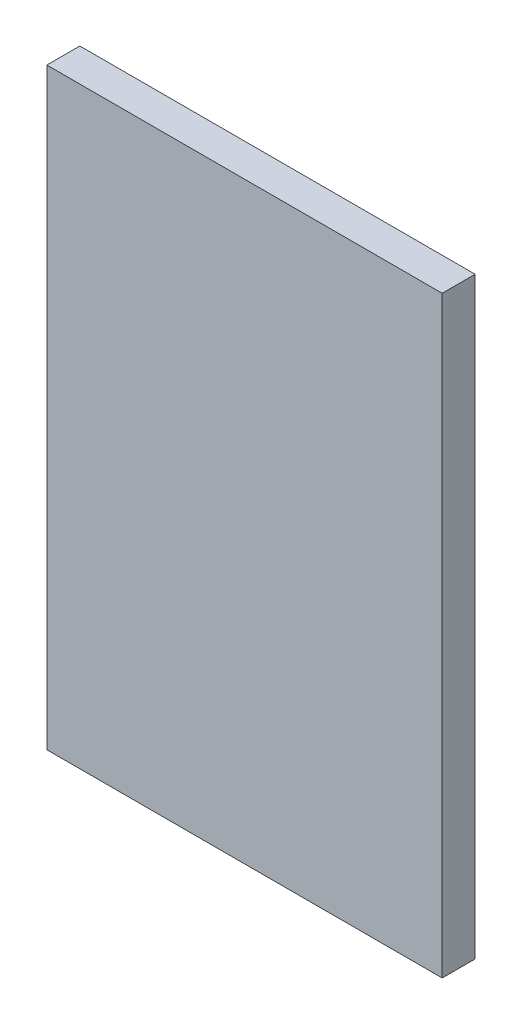
from build123d import *

# Parameters (mm, degrees)
SKETCH_1_W      = 12
SKETCH_1_H      = 18
EXTRUDE_1_DEPTH = 1


with BuildPart() as part:
    # 草图1 → 凸台-拉伸1 (new body)
    with BuildSketch(Plane.XY):
        Rectangle(SKETCH_1_W, SKETCH_1_H)
    extrude(amount=EXTRUDE_1_DEPTH)


solid = part.part
